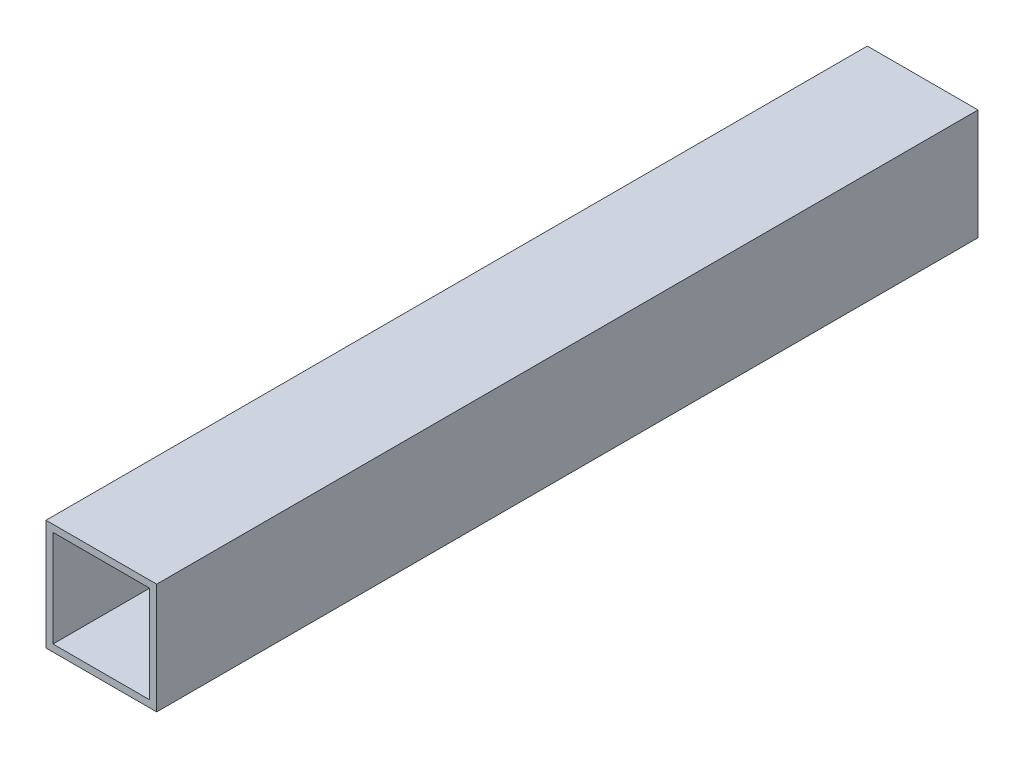
from build123d import *

# Parameters (mm, degrees)
SKETCH1_W           = 19
SKETCH1_H           = 19
SKETCH1_W_2         = 16.6
SKETCH1_H_2         = 16.6
BOSS_EXTRUDE2_DEPTH = 70.5


with BuildPart() as part:
    # Sketch1 → Boss-Extrude2 (new, symmetric)
    with BuildSketch(Plane.XY):
        Rectangle(SKETCH1_W, SKETCH1_H)
        Rectangle(SKETCH1_W_2, SKETCH1_H_2, mode=Mode.SUBTRACT)
    extrude(amount=BOSS_EXTRUDE2_DEPTH, both=True)


solid = part.part
